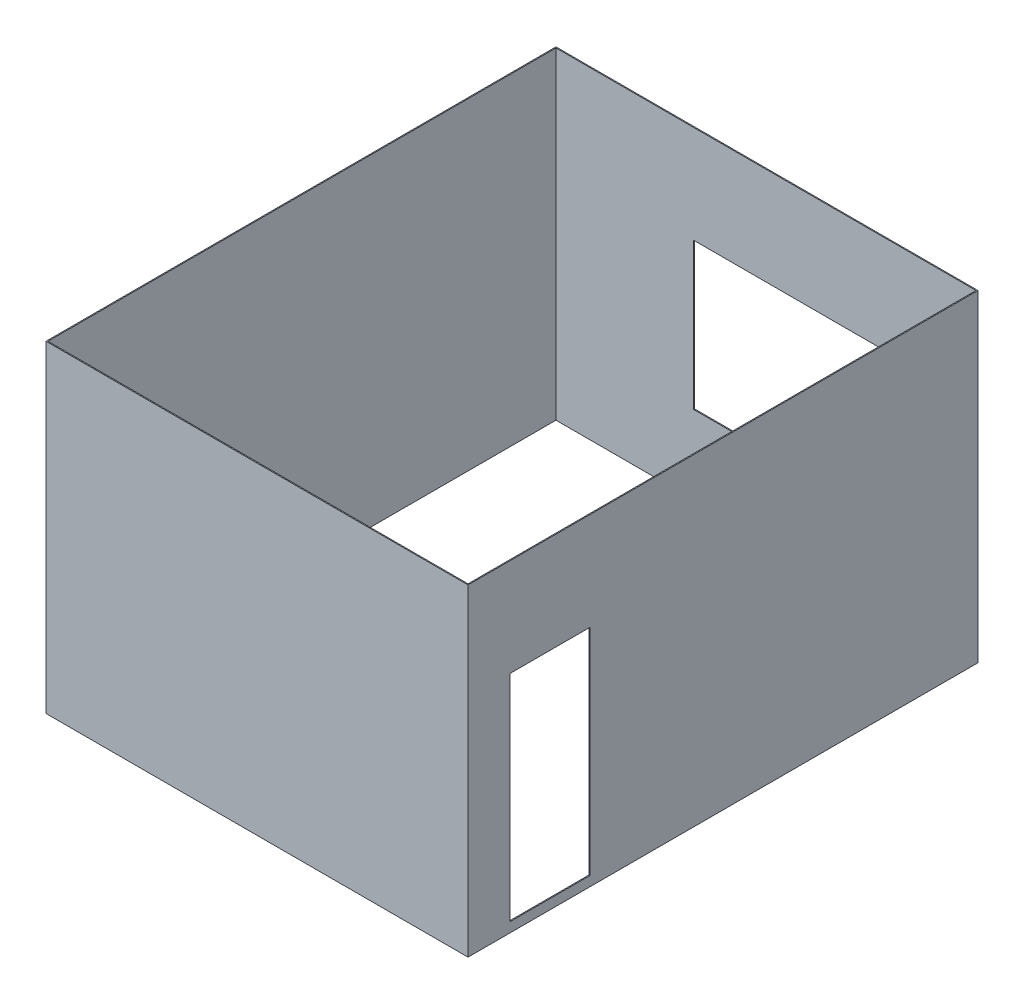
from build123d import *

# Parameters (mm, degrees)
SKETCH_1_W          = 432
SKETCH_1_H          = 522
SKETCH_1_W_2        = 430
SKETCH_1_H_2        = 520
EXTRUDE_2_DEPTH     = 330
SKETCH_2_W          = 82
SKETCH_2_H          = 220
CUT_EXTRUDE_2_DEPTH = 10
SKETCH_3_W          = 200
SKETCH_3_H          = 150
CUT_EXTRUDE_3_DEPTH = 10


with BuildPart() as part:
    # Эскиз1 → Вытянуть-Тонкостенный2 (new body)
    with BuildSketch(Plane(origin=(0, 0, 0), x_dir=(1, 0, 0), z_dir=(0, 1, 0))):
        with Locations((-215, 260)):
            Rectangle(SKETCH_1_W, SKETCH_1_H)
        with Locations((-215, 260)):
            Rectangle(SKETCH_1_W_2, SKETCH_1_H_2, mode=Mode.SUBTRACT)
    extrude(amount=EXTRUDE_2_DEPTH)

    # Эскиз2 → Вырез-Вытянуть2 (cut)
    with BuildSketch(Plane(origin=(1, 0, 0), x_dir=(0, 0, -1), z_dir=(1, 0, 0))):
        with Locations((83, 120)):
            Rectangle(SKETCH_2_W, SKETCH_2_H)
    extrude(amount=-CUT_EXTRUDE_2_DEPTH, mode=Mode.SUBTRACT)

    # Эскиз3 → Вырез-Вытянуть3 (cut)
    with BuildSketch(Plane(origin=(0, 0, -521), x_dir=(-1, 0, 0), z_dir=(0, 0, -1))):
        with Locations((189, 155)):
            Rectangle(SKETCH_3_W, SKETCH_3_H)
    extrude(amount=-CUT_EXTRUDE_3_DEPTH, mode=Mode.SUBTRACT)


solid = part.part
